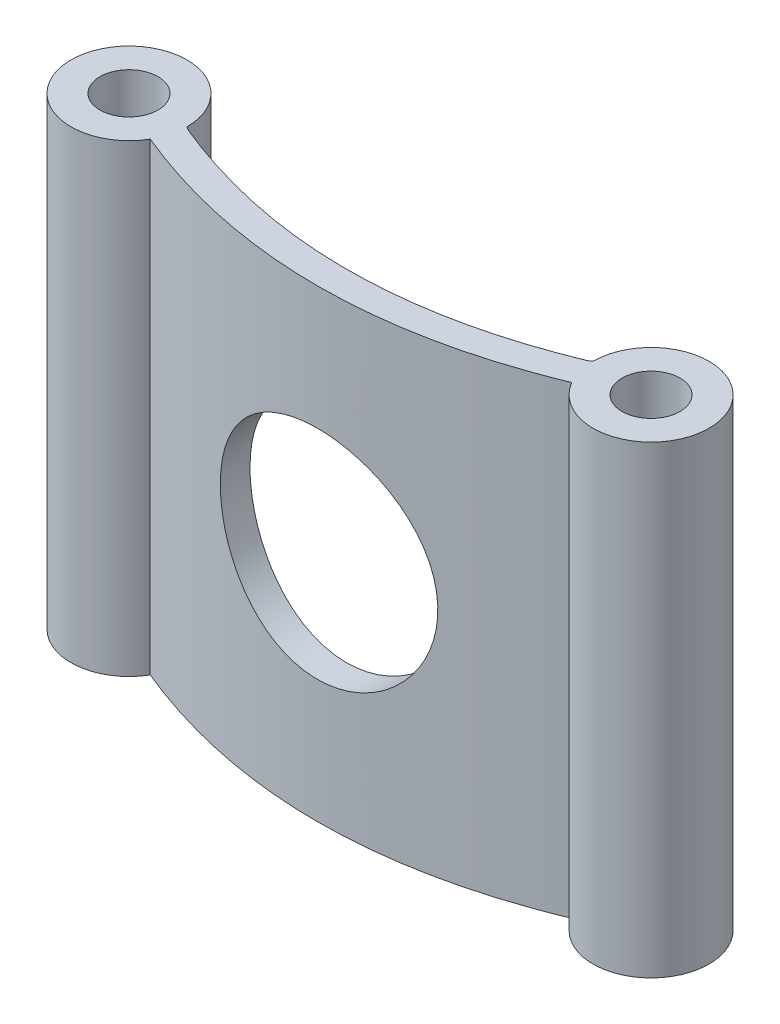
from build123d import *

# Parameters (mm, degrees)
SKETCH1_R           = 2
BOSS_EXTRUDE1_DEPTH = 32
SKETCH2_R           = 7.5
CUT_EXTRUDE1_DEPTH  = 25


with BuildPart() as part:
    # Sketch1 → Boss-Extrude1 (new body)
    with BuildSketch(Plane(origin=(0, 0, 0), x_dir=(1, 0, 0), z_dir=(0, 1, 0))):
        with BuildLine():
            Line((-13.772808121, -0.151299578), (-14, 0))
            ThreePointArc((-14, 0), (-21.863703305, 1.03527618), (-14.535898385, -2))
            add(Edge.make_bspline(
                [(-14.535898385, -2), (0, -8), (14.535898385, -2)],
                knots=[0, 0, 0, 1, 1, 1], degree=2))
            ThreePointArc((14.535898385, -2), (21.863703305, 1.03527618), (14, 0))
            Line((14, 0), (13.772808121, -0.151299578))
            add(Edge.make_bspline(
                [(-13.772808121, -0.151299578), (-13.200157242, -0.38767336), (-12.03616489, -0.83828907), (-9.734990662, -1.609651667), (-6.861177209, -2.35105477), (-3.427724467, -2.882094844), (0, -3.058952578), (3.427724467, -2.882094844), (6.861177209, -2.35105477), (9.734990662, -1.609651667), (12.03616489, -0.83828907), (13.200157242, -0.38767336), (13.772808121, -0.151299578)],
                knots=[0, 0, 0, 0, 0.0625, 0.125, 0.25, 0.375, 0.5, 0.625, 0.75, 0.875, 0.9375, 1, 1, 1, 1], degree=3))
        make_face()
        with Locations(Location((-18, 0, 0), (0, 0, 270))):
            Circle(SKETCH1_R, mode=Mode.SUBTRACT)
        with Locations(Location((18, 0, 0), (0, 0, 270))):
            Circle(SKETCH1_R, mode=Mode.SUBTRACT)
    extrude(amount=BOSS_EXTRUDE1_DEPTH)

    # Sketch2 → Cut-Extrude1 (cut)
    with BuildSketch(Plane.XY):
        with Locations(Location((0, 16, 0), (0, 0, 180))):
            Circle(SKETCH2_R)
    extrude(amount=CUT_EXTRUDE1_DEPTH, mode=Mode.SUBTRACT)


solid = part.part
